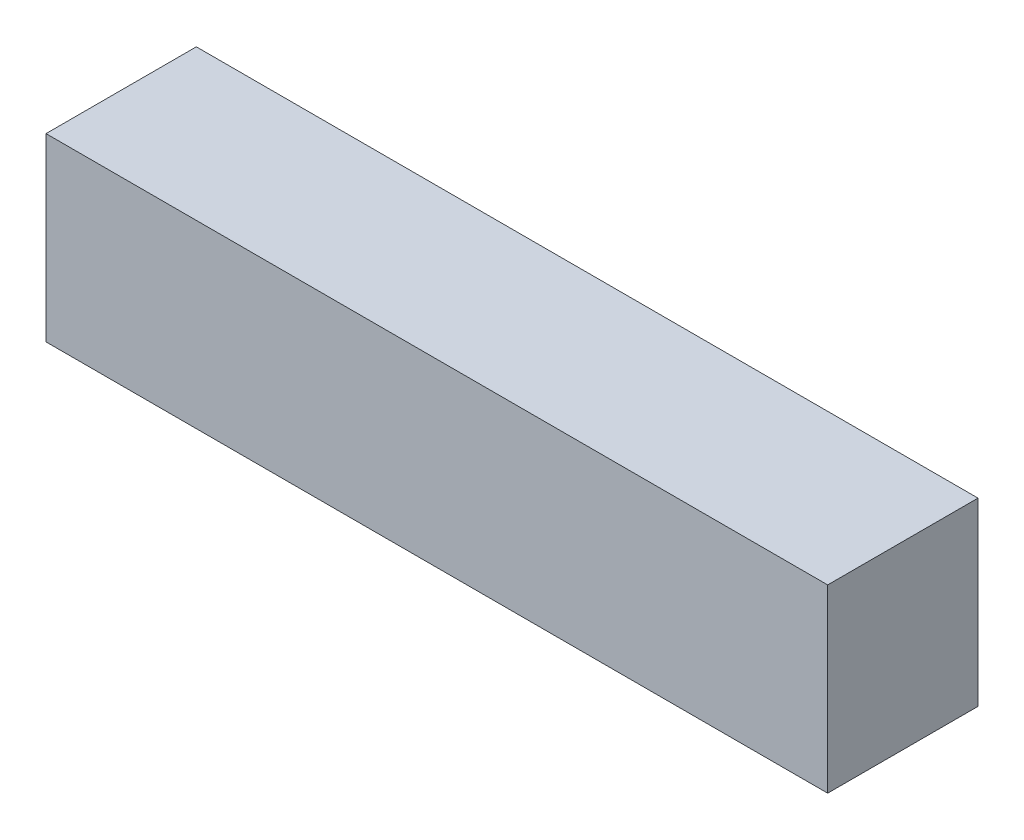
from build123d import *

# Parameters (mm, degrees)
SKETCH_1_W      = 156
SKETCH_1_H      = 30
EXTRUDE_1_DEPTH = 36


with BuildPart() as part:
    # 草图1 → 凸台-拉伸1 (new body)
    with BuildSketch(Plane(origin=(0, 0, 0), x_dir=(1, 0, 0), z_dir=(0, 1, 0))):
        Rectangle(SKETCH_1_W, SKETCH_1_H)
    extrude(amount=EXTRUDE_1_DEPTH)


solid = part.part
